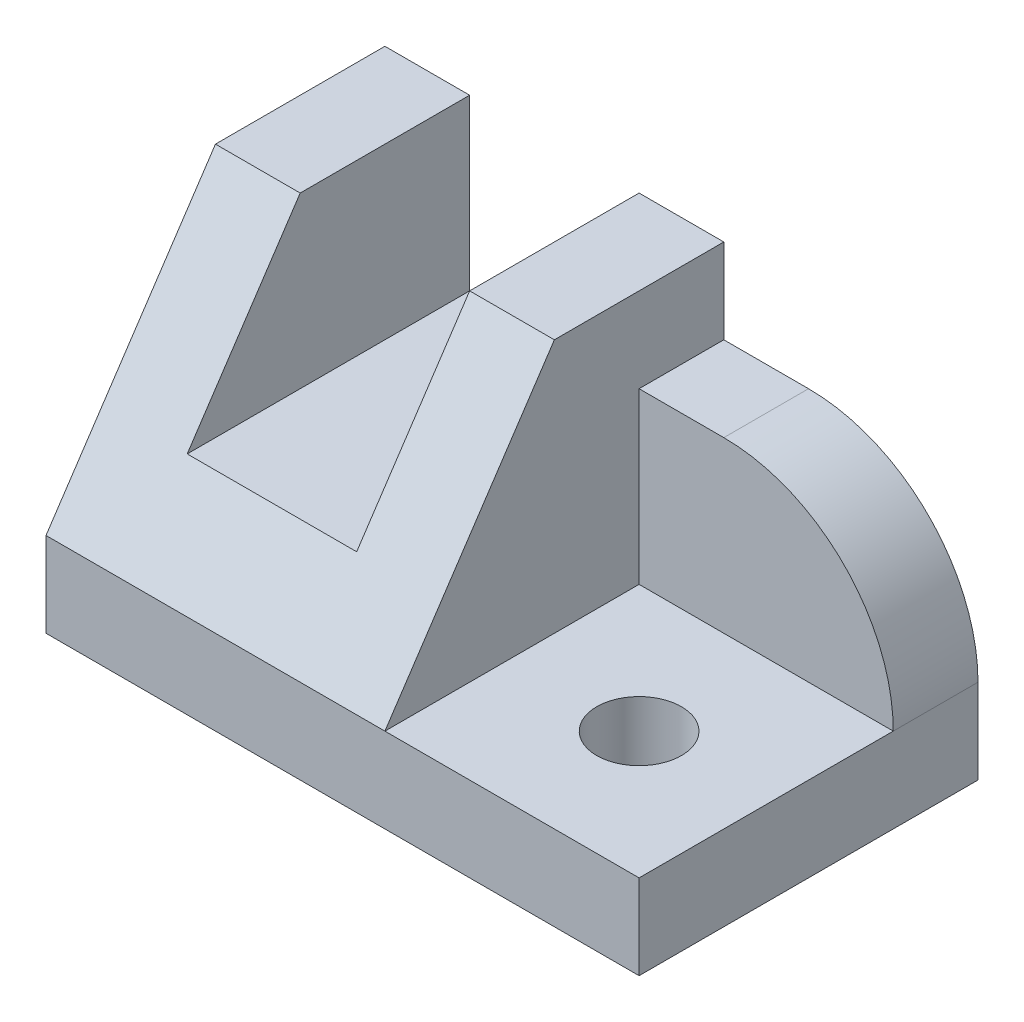
from build123d import *

# Parameters (mm, degrees)
BOSS_EXTRUDE1_DEPTH = 40
CUT_EXTRUDE1_DEPTH  = 91
SKETCH3_W           = 30
SKETCH3_H           = 30
CUT_EXTRUDE2_DEPTH  = 20
SKETCH4_R           = 5
CUT_EXTRUDE3_DEPTH  = 20


with BuildPart() as part:
    # Sketch1 → Boss-Extrude1 (new body)
    with BuildSketch(Plane.XY):
        with BuildLine():
            Line((0, 20), (-10, 20))
            Line((-10, 20), (-10, 30))
            Line((-10, 30), (-20, 30))
            Line((-20, 30), (-20, 10))
            Line((-20, 10), (-40, 10))
            Line((-40, 10), (-40, 30))
            Line((-40, 30), (-50, 30))
            Line((-50, 30), (-50, -10))
            Line((-50, -10), (20, -10))
            Line((20, -10), (20, 0))
            ThreePointArc((20, 0), (14.142135624, 14.142135624), (0, 20))
        make_face()
    extrude(amount=BOSS_EXTRUDE1_DEPTH)

    # Sketch2 → Cut-Extrude1 (cut)
    with BuildSketch(Plane.ZY.offset(50)):
        Polygon((20, 30), (40, 0), (40, 30), align=None)
    extrude(amount=-CUT_EXTRUDE1_DEPTH, mode=Mode.SUBTRACT)

    # Sketch3 → Cut-Extrude2 (cut)
    with BuildSketch(Plane(origin=(0, 20, 0), x_dir=(1, 0, 0), z_dir=(0, 1, 0))):
        with Locations((5, -25)):
            Rectangle(SKETCH3_W, SKETCH3_H)
    extrude(amount=-CUT_EXTRUDE2_DEPTH, mode=Mode.SUBTRACT)

    # Sketch4 → Cut-Extrude3 (cut)
    with BuildSketch(Plane(origin=(0, 0, 0), x_dir=(1, 0, 0), z_dir=(0, 1, 0))):
        with Locations(Location((5, -25, 0), (0, 0, 270))):
            Circle(SKETCH4_R)
    extrude(amount=-CUT_EXTRUDE3_DEPTH, mode=Mode.SUBTRACT)


solid = part.part
